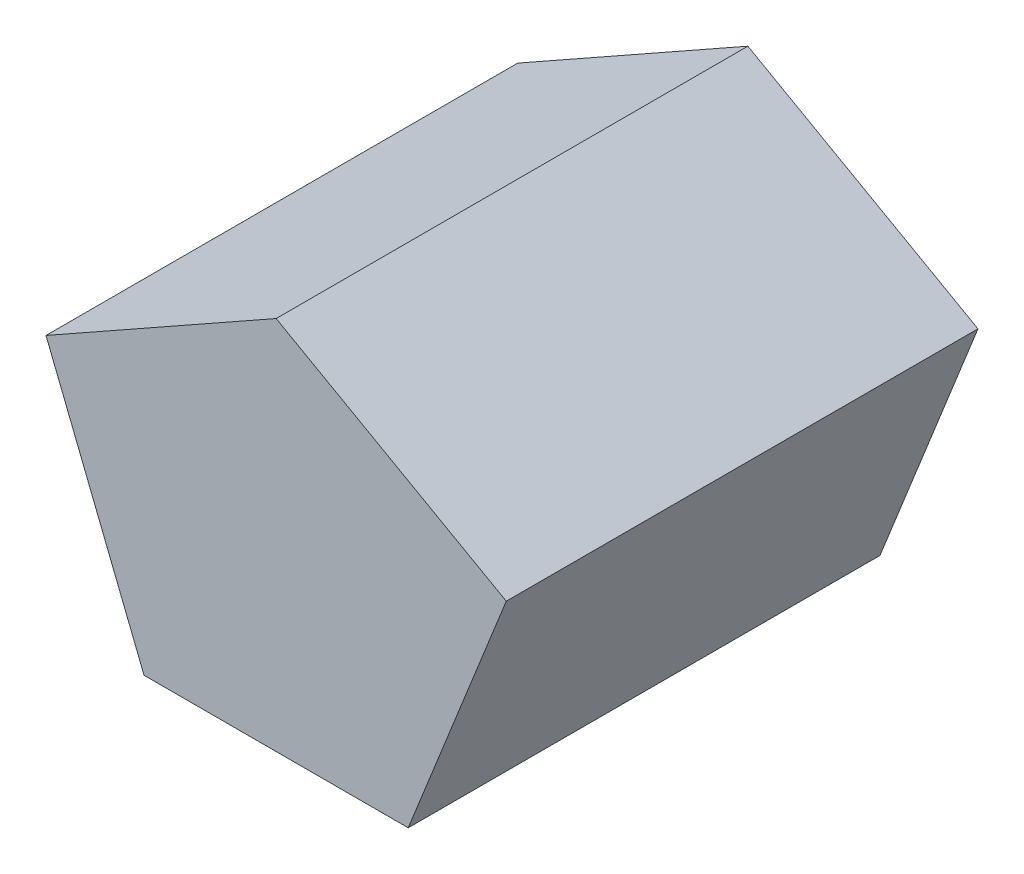
from build123d import *

# Parameters (mm, degrees)
SALIENTE_EXTRUIR1_DEPTH = 50
CROQUIS3_R              = 5
CORTAR_EXTRUIR1_DEPTH   = 10


with BuildPart() as part:
    # Croquis2 → Saliente-Extruir1 (new body)
    with BuildSketch(Plane.XY):
        Polygon((0.370632199, 31.320595283), (-24.021672647, 17.572305777), (-13.629367801, -8.427694223), (14.370632199, -8.427694223), (24.762937044, 17.572305777), align=None)
    extrude(amount=SALIENTE_EXTRUIR1_DEPTH)

    # Croquis3 → Cortar-Extruir1 (cut)
    with BuildSketch(Plane(origin=(0, 0, 0), x_dir=(-1, 0, 0), z_dir=(0, 0, -1))):
        with Locations((0, 6.620486491)):
            Circle(CROQUIS3_R)
    extrude(amount=-CORTAR_EXTRUIR1_DEPTH, mode=Mode.SUBTRACT)


solid = part.part
